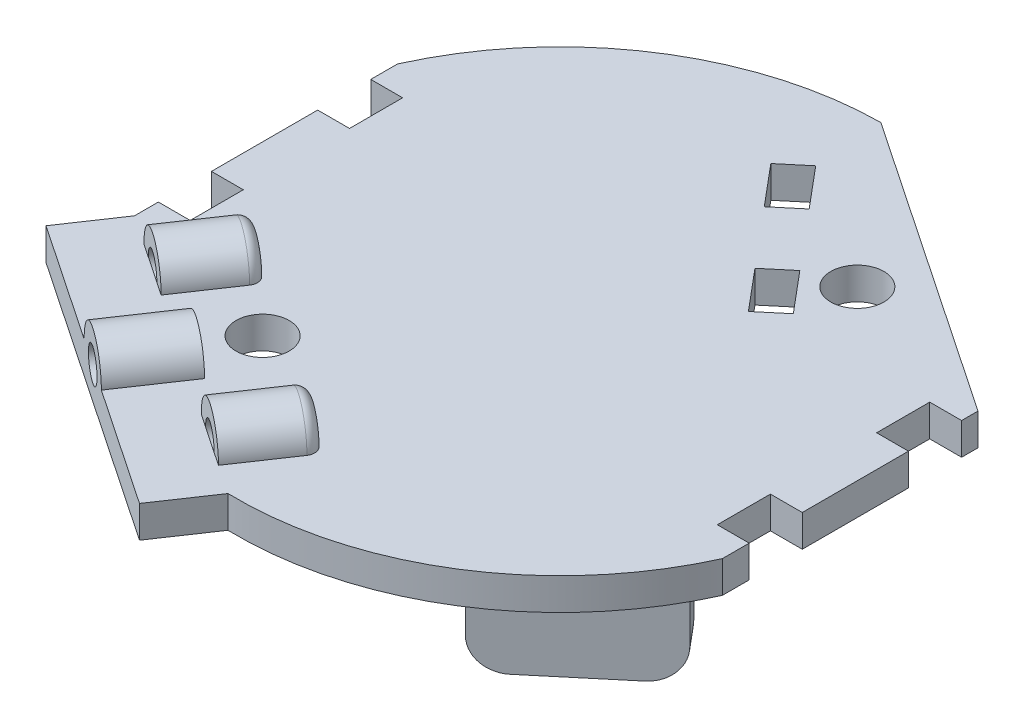
from build123d import *

# Parameters (mm, degrees)
CROQUIS1_R              = 30.5
SALIENTE_EXTRUIR1_DEPTH = 3
CORTAR_EXTRUIR3_START   = -4
CORTAR_EXTRUIR3_DEPTH   = 4
CORTAR_EXTRUIR6_DEPTH   = 10
CROQUIS10_R             = 2.5
CORTAR_EXTRUIR7_DEPTH   = 10
CORTAR_EXTRUIR8_START   = -3
CORTAR_EXTRUIR8_DEPTH   = 3
SALIENTE_EXTRUIR2_DEPTH = 10
REDONDEO1_R             = 3
REDONDEO2_R             = 1
CORTAR_EXTRUIR9_START   = -3
CORTAR_EXTRUIR9_DEPTH   = 3
CORTAR_EXTRUIR10_START  = -10
CORTAR_EXTRUIR10_DEPTH  = 10
CROQUIS19_R             = 3
SALIENTE_EXTRUIR5_DEPTH = 7
CROQUIS20_R             = 1.5
CORTAR_EXTRUIR12_DEPTH  = 6
REDONDEO3_R             = 1
CROQUIS16_W             = 32.622025527
CROQUIS16_H             = 3
SALIENTE_EXTRUIR3_DEPTH = 6
CROQUIS17_R             = 3
SALIENTE_EXTRUIR4_DEPTH = 7
CROQUIS18_R             = 1.5
CORTAR_EXTRUIR11_DEPTH  = 6


with BuildPart() as part:
    # Croquis1 → Saliente-Extruir1 (new body)
    with BuildSketch(Plane(origin=(0, 0, 0), x_dir=(1, 0, 0), z_dir=(0, 1, 0))):
        with Locations(Location((0, 0, 0), (0, 0, 270))):
            Circle(CROQUIS1_R)
    extrude(amount=SALIENTE_EXTRUIR1_DEPTH)

    # Croquis5 → Cortar-Extruir3 (cut)
    with BuildSketch(Plane(origin=(0, 3, 0), x_dir=(1, 0, 0), z_dir=(0, 1, 0)).offset(CORTAR_EXTRUIR3_START)):
        with BuildLine():
            Line((28.814059068, 5), (30.087372767, 5))
            ThreePointArc((30.087372767, 5), (29.556634924, 7.526973624), (28.814059068, 10))
            Line((28.814059068, 10), (24.814059068, 10))
            Line((24.814059068, 10), (24.814059068, 5))
            Line((24.814059068, 5), (28.814059068, 5))
        make_face()
        with BuildLine():
            Line((30.087372767, -5), (28.814059068, -5))
            Line((28.814059068, -5), (24.814059068, -5))
            Line((24.814059068, -5), (24.814059068, -10))
            Line((24.814059068, -10), (28.814059068, -10))
            ThreePointArc((28.814059068, -10), (29.556634924, -7.526973624), (30.087372767, -5))
        make_face()
        with BuildLine():
            Line((-24.814059068, 5), (-24.814059068, 10))
            Line((-24.814059068, 10), (-28.814059068, 10))
            ThreePointArc((-28.814059068, 10), (-29.556634924, 7.526973624), (-30.087372767, 5))
            Line((-30.087372767, 5), (-28.814059068, 5))
            Line((-28.814059068, 5), (-24.814059068, 5))
        make_face()
        with BuildLine():
            Line((-28.814059068, -10), (-24.814059068, -10))
            Line((-24.814059068, -10), (-24.814059068, -5))
            Line((-24.814059068, -5), (-28.814059068, -5))
            Line((-28.814059068, -5), (-30.087372767, -5))
            ThreePointArc((-30.087372767, -5), (-29.556634924, -7.526973624), (-28.814059068, -10))
        make_face()
    extrude(amount=CORTAR_EXTRUIR3_DEPTH, mode=Mode.SUBTRACT)

    # Croquis9 → Cortar-Extruir6 (cut)
    with BuildSketch(Plane(origin=(0, 3, 0), x_dir=(1, 0, 0), z_dir=(0, 1, 0))):
        Polygon((5.673284852, 12.685390231), (8.887222901, 8.855168016), (11.18535623, 10.783530845), (7.971418181, 14.613753061), align=None)
        Polygon((-2.120514915, 21.973679104), (1.093423133, 18.143456889), (3.391556462, 20.071819718), (0.177618414, 23.902041933), align=None)
    extrude(amount=-CORTAR_EXTRUIR6_DEPTH, mode=Mode.SUBTRACT)

    # Croquis10 → Cortar-Extruir7 (cut)
    with BuildSketch(Plane(origin=(0, 3, 0), x_dir=(1, 0, 0), z_dir=(0, 1, 0))):
        with Locations(Location((12, 16, 0), (0, 0, 270))):
            Circle(CROQUIS10_R)
        with Locations(Location((-12, -16, 0), (0, 0, 270))):
            Circle(CROQUIS10_R)
    extrude(amount=-CORTAR_EXTRUIR7_DEPTH, mode=Mode.SUBTRACT)

    # Croquis11 → Cortar-Extruir8 (cut)
    with BuildSketch(Plane(origin=(0, 3, 0), x_dir=(1, 0, 0), z_dir=(0, 1, 0)).offset(CORTAR_EXTRUIR8_START)):
        with BuildLine():
            ThreePointArc((-28.814059068, -10), (-28.341972277, -11.268655974), (-27.814059068, -12.515115586))
            Line((-27.814059068, -12.515115586), (-27.814059068, -10))
            Line((-27.814059068, -10), (-28.814059068, -10))
        make_face()
        with BuildLine():
            Line((-27.814059068, -5), (-27.814059068, 5))
            Line((-27.814059068, 5), (-30.087372767, 5))
            ThreePointArc((-30.087372767, 5), (-30.5, 0), (-30.087372767, -5))
            Line((-30.087372767, -5), (-27.814059068, -5))
        make_face()
        with BuildLine():
            Line((-27.814059068, 10), (-27.814059068, 12.515115586))
            ThreePointArc((-27.814059068, 12.515115586), (-28.341972277, 11.268655974), (-28.814059068, 10))
            Line((-28.814059068, 10), (-27.814059068, 10))
        make_face()
        with BuildLine():
            Line((28.814059068, -10), (27.814059068, -10))
            Line((27.814059068, -10), (27.814059068, -12.515115586))
            ThreePointArc((27.814059068, -12.515115586), (28.341972277, -11.268655974), (28.814059068, -10))
        make_face()
        with BuildLine():
            Line((30.087372767, 5), (27.814059068, 5))
            Line((27.814059068, 5), (27.814059068, -5))
            Line((27.814059068, -5), (30.087372767, -5))
            ThreePointArc((30.087372767, -5), (30.5, 0), (30.087372767, 5))
        make_face()
        with BuildLine():
            Line((27.814059068, 12.515115586), (27.814059068, 10))
            Line((27.814059068, 10), (28.814059068, 10))
            ThreePointArc((28.814059068, 10), (28.341972277, 11.268655974), (27.814059068, 12.515115586))
        make_face()
    extrude(amount=CORTAR_EXTRUIR8_DEPTH, mode=Mode.SUBTRACT)

    # Croquis13 → Saliente-Extruir2 (add)
    with BuildSketch(Plane.XZ):
        Polygon((-6.816688183, 4.321977983), (-19.672440377, -10.99891088), (-17.374307048, -12.927273709), (-4.518554854, 2.393615154), align=None)
        Polygon((21.527275636, 8.931176939), (23.455638465, 11.229310268), (11.964971818, 20.871124414), (10.036608989, 18.572991084), align=None)
    extrude(amount=SALIENTE_EXTRUIR2_DEPTH)

    # Redondeo1
    redondeo1_edges = [part.edges().sort_by_distance(p)[0] for p in [
        (-5.667621519, -10, 3.357796568),
        (-18.523373712, -10, -11.963092294),
        (22.49145705, -10, 10.080243604),
        (11.000790403, -10, 19.722057749),
    ]]
    fillet(redondeo1_edges, radius=REDONDEO1_R)

    # Redondeo2
    redondeo2_edges = [part.edges().sort_by_distance(p)[0] for p in [
        (-5.667621519, 0, 3.357796568),
        (-13.24456428, 0, -3.338466449),
        (-18.523373712, 0, -11.963092294),
        (22.49145705, 0, 10.080243604),
        (17.710305141, 0, 16.050217341),
        (11.000790403, 0, 19.722057749),
    ]]
    fillet(redondeo2_edges, radius=REDONDEO2_R)

    # Croquis14 → Cortar-Extruir9 (cut)
    with BuildSketch(Plane(origin=(0, 3, 0), x_dir=(1, 0, 0), z_dir=(0, 1, 0)).offset(CORTAR_EXTRUIR9_START)):
        with BuildLine():
            Line((-0.28585192, 30.498660441), (27.814059068, 11.545031156))
            Line((27.814059068, 11.545031156), (27.814059068, 12.515115586))
            ThreePointArc((27.814059068, 12.515115586), (16.440879495, 25.689442995), (-0.28585192, 30.498660441))
        make_face()
    extrude(amount=CORTAR_EXTRUIR9_DEPTH, mode=Mode.SUBTRACT)

    # Croquis15 → Cortar-Extruir10 (cut)
    with BuildSketch(Plane(origin=(0, 3, 0), x_dir=(1, 0, 0), z_dir=(0, 1, 0)).offset(CORTAR_EXTRUIR10_START)):
        with BuildLine():
            Line((-27.814059068, -12.24829445), (-27.814059068, -12.515115586))
            ThreePointArc((-27.814059068, -12.515115586), (-16.882746118, -25.401237834), (-0.769174213, -30.490299622))
            Line((-0.769174213, -30.490299622), (-27.814059068, -12.24829445))
        make_face()
    extrude(amount=CORTAR_EXTRUIR10_DEPTH, mode=Mode.SUBTRACT)

    # Croquis19 → Saliente-Extruir5 (add)
    with BuildSketch(Plane(origin=(-14.375575006, 0, 21.312666404), x_dir=(0.8290375725550415, 0, 0.5591929034707471), z_dir=(-0.5591929034707471, 0, 0.8290375725550415))):
        with Locations((10.101272087, 3)):
            Circle(CROQUIS19_R)
        with Locations((-9.898727913, 3)):
            Circle(CROQUIS19_R)
    extrude(amount=-SALIENTE_EXTRUIR5_DEPTH)

    # Croquis20 → Cortar-Extruir12 (cut)
    with BuildSketch(Plane(origin=(-14.375575006, 0, 21.312666404), x_dir=(0.8290375725550415, 0, 0.5591929034707471), z_dir=(-0.5591929034707471, 0, 0.8290375725550415))):
        with Locations((10.101272087, 3)):
            Circle(CROQUIS20_R)
        with Locations((-9.898727913, 3)):
            Circle(CROQUIS20_R)
    extrude(amount=-CORTAR_EXTRUIR12_DEPTH, mode=Mode.SUBTRACT)

    # Redondeo3
    redondeo3_edges = [part.edges().sort_by_distance(p)[0] for p in [
        (-2.086890591, 6, 21.157963063),
        (-18.667642042, 6, 9.974104993),
    ]]
    fillet(redondeo3_edges, radius=REDONDEO3_R)

    # Croquis16 → Saliente-Extruir3 (add)
    with BuildSketch(Plane(origin=(-14.375575006, 0, 21.312666404), x_dir=(0.8290375725550415, 0, 0.5591929034707471), z_dir=(-0.5591929034707471, 0, 0.8290375725550415))):
        with Locations((0.101272086, 1.5)):
            Rectangle(CROQUIS16_W, CROQUIS16_H)
    extrude(amount=SALIENTE_EXTRUIR3_DEPTH)

    # Croquis17 → Saliente-Extruir4 (add)
    with BuildSketch(Plane(origin=(-17.730732427, 0, 26.286891839), x_dir=(0.8290375725550415, 0, 0.5591929034707471), z_dir=(-0.5591929034707471, 0, 0.8290375725550415))):
        with Locations((0.101272087, 3)):
            Circle(CROQUIS17_R)
    extrude(amount=-SALIENTE_EXTRUIR4_DEPTH)

    # Croquis18 → Cortar-Extruir11 (cut)
    with BuildSketch(Plane(origin=(-17.730732427, 0, 26.286891839), x_dir=(0.8290375725550415, 0, 0.5591929034707471), z_dir=(-0.5591929034707471, 0, 0.8290375725550415))):
        with Locations((0.101272087, 3)):
            Circle(CROQUIS18_R)
    extrude(amount=-CORTAR_EXTRUIR11_DEPTH, mode=Mode.SUBTRACT)


solid = part.part
